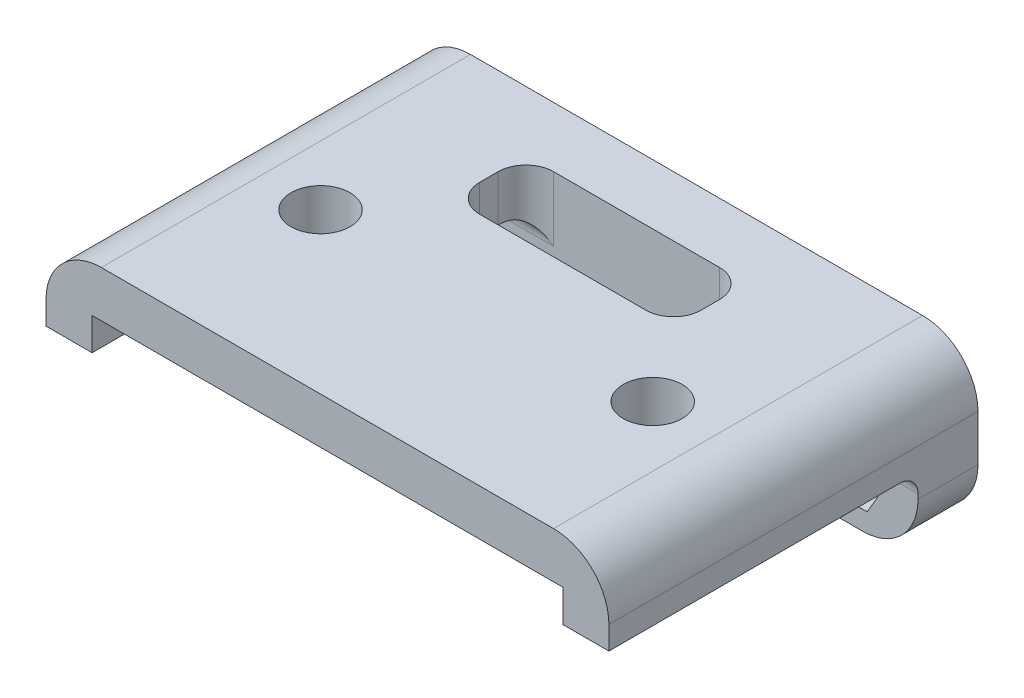
from build123d import *

# Parameters (mm, degrees)
SKETCH1_W           = 30.5
SKETCH1_H           = 8.5
BOSS_EXTRUDE1_DEPTH = 20
SHELL1_T            = -2.5
SKETCH2_W           = 12
SKETCH2_H           = 16
CUT_EXTRUDE2_DEPTH  = 3
SKETCH3_W           = 12
SKETCH3_H           = 4
CUT_EXTRUDE3_DEPTH  = 4
SKETCH4_R           = 1.6
CUT_EXTRUDE4_DEPTH  = 10
FILLET1_R           = 3
FILLET2_R           = 3
FILLET3_R           = 3
FILLET4_R           = 3
SKETCH5_R           = 1.45
CUT_EXTRUDE5_DEPTH  = 29
SKETCH12_W          = 25.5
SKETCH12_H          = 3.5
BOSS_EXTRUDE3_DEPTH = 0.75
SKETCH13_R          = 1.462025065
SKETCH13_R_2        = 1.459070956
CUT_EXTRUDE6_DEPTH  = 2
CUT_EXTRUDE7_START  = -2
CUT_EXTRUDE7_DEPTH  = 5
FILLET5_R           = 1.5
FILLET6_R           = 1.5
FILLET7_R           = 1.5
FILLET8_R           = 1.5
FILLET9_R           = 1
FILLET10_R          = 1
CUT_EXTRUDE8_REACH  = 27.507
SKETCH15_W          = 30.5
SKETCH15_H          = 4.25
FILLET13_R          = 1
FILLET14_R          = 1
FILLET15_R          = 1
CUT_EXTRUDE9_DEPTH  = 1.75


with BuildPart() as part:
    # Sketch1 → Boss-Extrude1 (new body)
    with BuildSketch(Plane.XY):
        Rectangle(SKETCH1_W, SKETCH1_H)
    extrude(amount=BOSS_EXTRUDE1_DEPTH)

    # Shell1
    shell1_openings = [part.faces().sort_by_distance(p)[0] for p in [
        (0, 0, 20),
    ]]
    offset(amount=SHELL1_T, openings=shell1_openings, kind=Kind.INTERSECTION)

    # Sketch2 → Cut-Extrude2 (cut)
    with BuildSketch(Plane.XZ.offset(4.25)):
        with Locations((0, 12)):
            Rectangle(SKETCH2_W, SKETCH2_H)
    extrude(amount=-CUT_EXTRUDE2_DEPTH, mode=Mode.SUBTRACT)

    # Sketch3 → Cut-Extrude3 (cut)
    with BuildSketch(Plane(origin=(0, 4.25, 0), x_dir=(1, 0, 0), z_dir=(0, 1, 0))):
        with Locations((0, -5.25)):
            Rectangle(SKETCH3_W, SKETCH3_H)
    extrude(amount=-CUT_EXTRUDE3_DEPTH, mode=Mode.SUBTRACT)

    # Sketch4 → Cut-Extrude4 (cut)
    with BuildSketch(Plane(origin=(0, 4.25, 0), x_dir=(1, 0, 0), z_dir=(0, 1, 0))):
        with Locations(Location((8.9747, -11.35, 0), (0, 0, 270))):
            Circle(SKETCH4_R)
        with Locations(Location((-9.0253, -11.35, 0), (0, 0, 270))):
            Circle(SKETCH4_R)
    extrude(amount=-CUT_EXTRUDE4_DEPTH, mode=Mode.SUBTRACT)

    # Fillet1
    fillet1_edges = [part.edges().sort_by_distance(p)[0] for p in [
        (15.25, 4.25, 10),
    ]]
    fillet(fillet1_edges, radius=FILLET1_R)

    # Fillet2
    fillet2_edges = [part.edges().sort_by_distance(p)[0] for p in [
        (-15.25, 4.25, 10),
    ]]
    fillet(fillet2_edges, radius=FILLET2_R)

    # Fillet3
    fillet3_edges = [part.edges().sort_by_distance(p)[0] for p in [
        (15.25, -4.25, 10),
    ]]
    fillet(fillet3_edges, radius=FILLET3_R)

    # Fillet4
    fillet4_edges = [part.edges().sort_by_distance(p)[0] for p in [
        (-15.25, -4.25, 10),
    ]]
    fillet(fillet4_edges, radius=FILLET4_R)

    # Sketch5 → Cut-Extrude5 (cut)
    with BuildSketch(Plane(origin=(0, 0, 0), x_dir=(-1, 0, 0), z_dir=(0, 0, -1))):
        with Locations((-10.75, -0.182916649)):
            Circle(SKETCH5_R)
        with Locations((10.75, -0.182916649)):
            Circle(SKETCH5_R)
    extrude(amount=-CUT_EXTRUDE5_DEPTH, mode=Mode.SUBTRACT)

    # Sketch12 → Boss-Extrude3 (add)
    with BuildSketch(Plane.XY.offset(2.5)):
        Rectangle(SKETCH12_W, SKETCH12_H)
    extrude(amount=BOSS_EXTRUDE3_DEPTH)

    # Sketch13 → Cut-Extrude6 (cut)
    with BuildSketch(Plane.XY.offset(4)):
        with Locations((-10.75, -0.182916649)):
            Circle(SKETCH13_R)
        with Locations((10.75, -0.182916649)):
            Circle(SKETCH13_R_2)
    extrude(amount=-CUT_EXTRUDE6_DEPTH, mode=Mode.SUBTRACT)

    # Sketch14 → Cut-Extrude7 (cut)
    with BuildSketch(Plane.XY.offset(4).offset(CUT_EXTRUDE7_START)):
        Polygon((-7.25, -0.182916649), (-9, 2.848172265), (-12.5, 2.848172265), (-14.25, -0.182916649), (-12.5, -3.214005562), (-9, -3.214005562), align=None)
        Polygon((14.25, -0.182916649), (12.5, 2.848172265), (9, 2.848172265), (7.25, -0.182916649), (9, -3.214005562), (12.5, -3.214005562), align=None)
    extrude(amount=CUT_EXTRUDE7_DEPTH, mode=Mode.SUBTRACT)

    # Fillet5
    fillet5_edges = [part.edges().sort_by_distance(p)[0] for p in [
        (6, 3, 7.25),
    ]]
    fillet(fillet5_edges, radius=FILLET5_R)

    # Fillet6
    fillet6_edges = [part.edges().sort_by_distance(p)[0] for p in [
        (-6, 3, 7.25),
    ]]
    fillet(fillet6_edges, radius=FILLET6_R)

    # Fillet7
    fillet7_edges = [part.edges().sort_by_distance(p)[0] for p in [
        (-6, 3, 3.25),
    ]]
    fillet(fillet7_edges, radius=FILLET7_R)

    # Fillet8
    fillet8_edges = [part.edges().sort_by_distance(p)[0] for p in [
        (6, 3, 3.25),
    ]]
    fillet(fillet8_edges, radius=FILLET8_R)

    # Fillet9
    fillet9_edges = [part.edges().sort_by_distance(p)[0] for p in [
        (6, -3, 4),
    ]]
    fillet(fillet9_edges, radius=FILLET9_R)

    # Fillet10
    fillet10_edges = [part.edges().sort_by_distance(p)[0] for p in [
        (-6, -3, 4),
    ]]
    fillet(fillet10_edges, radius=FILLET10_R)

    # Cut-Extrude8: up to this face of the body (flat: up to its plane)
    cut_extrude8_end = Plane(part.part.faces().sort_by_distance((0, 0.887010367, 3.25))[0])
    # Sketch15 → Cut-Extrude8 (cut, up to the picked face)
    with BuildSketch(Plane.XY.offset(20), mode=Mode.PRIVATE) as cut_extrude8_sk1:
        with Locations((0, -2.125)):
            Rectangle(SKETCH15_W, SKETCH15_H)
    cut_extrude8_tool1 = split(extrude(cut_extrude8_sk1.sketch, amount=-CUT_EXTRUDE8_REACH, mode=Mode.PRIVATE), bisect_by=cut_extrude8_end, keep=Keep.BOTH, mode=Mode.PRIVATE)
    add(cut_extrude8_tool1.solids().sort_by(Axis((0, -2.125, 20), (0, 0, -1)))[0], mode=Mode.SUBTRACT)

    # Fillet13
    fillet13_edges = [part.edges().sort_by_distance(p)[0] for p in [
        (14.697196512, 0, 3.25),
    ]]
    fillet(fillet13_edges, radius=FILLET13_R)

    # Fillet14
    fillet14_edges = [part.edges().sort_by_distance(p)[0] for p in [
        (-14.697196512, 0, 3.25),
    ]]
    fillet(fillet14_edges, radius=FILLET14_R)

    # Fillet15
    fillet15_edges = [part.edges().sort_by_distance(p)[0] for p in [
        (-6.432984974, 1.75, 3.25),
        (6.432984974, 1.75, 3.25),
    ]]
    fillet(fillet15_edges, radius=FILLET15_R)

    # Sketch16 → Cut-Extrude9 (cut)
    with BuildSketch(Plane.XZ):
        with BuildLine():
            Line((-10.06119106, 15.213538496), (-10.061191059, 7.486461504))
            ThreePointArc((-10.061191059, 7.486461504), (-13.0253, 11.35), (-10.06119106, 15.213538496))
        make_face()
        with BuildLine():
            Line((10.01059106, 15.213538496), (10.010591059, 7.486461504))
            ThreePointArc((10.010591059, 7.486461504), (12.9747, 11.35), (10.01059106, 15.213538496))
        make_face()
    extrude(amount=-CUT_EXTRUDE9_DEPTH, mode=Mode.SUBTRACT)


solid = part.part
